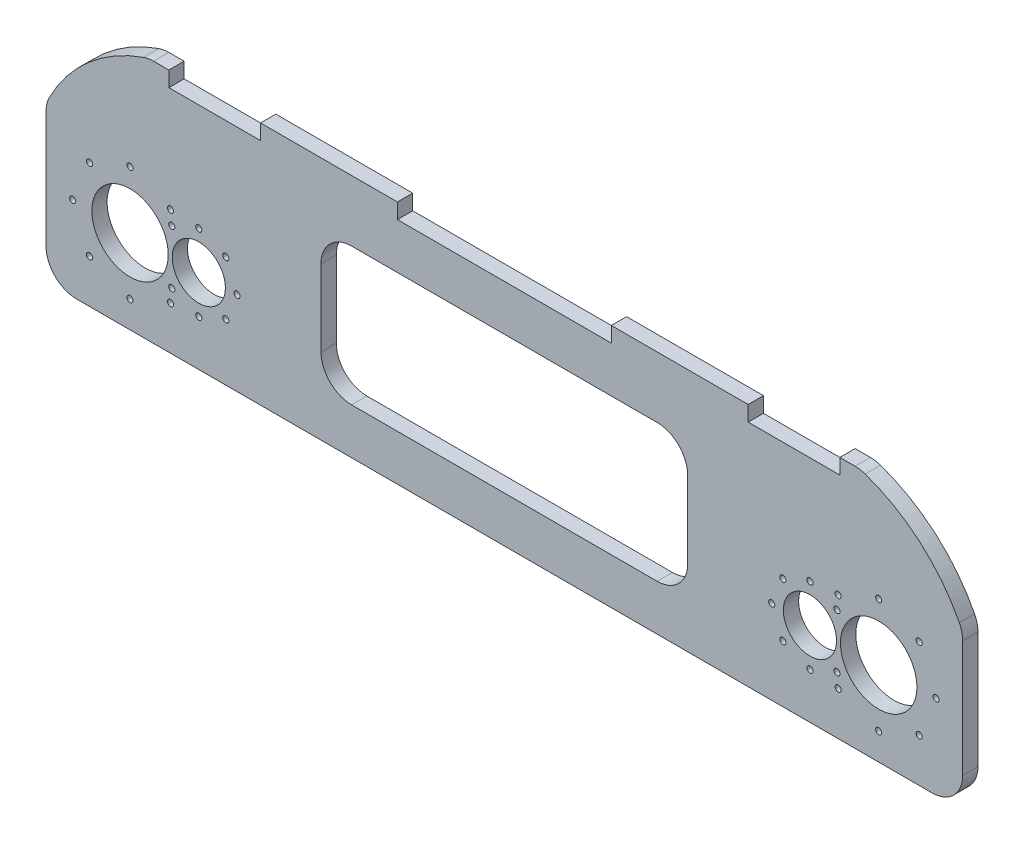
from build123d import *

# Parameters (mm, degrees)
SKETCH1_R           = 3.175
BOSS_EXTRUDE1_DEPTH = 3.175
SKETCH2_R           = 11.049
SKETCH2_R_2         = 15.875
SKETCH2_R_3         = 1.27
CUT_EXTRUDE1_DEPTH  = 202.930998425
SKETCH3_W           = 38.1
SKETCH3_H           = 6.35
SKETCH3_W_2         = 88.9
CUT_EXTRUDE4_DEPTH  = 202.930998425
CUT_EXTRUDE5_DEPTH  = 202.930998425


with BuildPart() as part:
    # Sketch1 → Boss-Extrude1 (new, symmetric)
    with BuildSketch(Plane.XY):
        with BuildLine():
            Line((-145.783553311, 66.675), (145.783553311, 66.675))
            ThreePointArc((145.783553311, 66.675), (147.900219978, 66.497368874), (149.957676269, 65.969444444))
            ThreePointArc((149.957676269, 65.969444444), (172.789871953, 52.74760778), (189.088888889, 31.999880883))
            ThreePointArc((189.088888889, 31.999880883), (190.142181511, 29.17513943), (190.5, 26.181720723))
            Line((190.5, 26.181720723), (190.5, -22.225))
            ThreePointArc((190.5, -22.225), (186.780256121, -31.205256121), (177.8, -34.925))
            Line((177.8, -34.925), (-177.8, -34.925))
            ThreePointArc((-177.8, -34.925), (-186.780256121, -31.205256121), (-190.5, -22.225))
            Line((-190.5, -22.225), (-190.5, 26.181720723))
            ThreePointArc((-190.5, 26.181720723), (-190.142181511, 29.17513943), (-189.088888889, 31.999880883))
            ThreePointArc((-189.088888889, 31.999880883), (-172.789871953, 52.74760778), (-149.957676269, 65.969444444))
            ThreePointArc((-149.957676269, 65.969444444), (-147.900219978, 66.497368874), (-145.783553311, 66.675))
        make_face()
        with Locations((-127, 0)):
            Circle(SKETCH1_R, mode=Mode.SUBTRACT)
        with Locations((127, 0)):
            Circle(SKETCH1_R, mode=Mode.SUBTRACT)
    extrude(amount=BOSS_EXTRUDE1_DEPTH, both=True)

    # Sketch2 → Cut-Extrude1 (cut, through all)
    with BuildSketch(Plane.XY.offset(3.175)):
        with Locations((-127, 0)):
            Circle(SKETCH2_R)
        with Locations((-155.575, 0)):
            Circle(SKETCH2_R_2)
        with Locations((-155.575, 23.8125)):
            Circle(SKETCH2_R_3)
        with Locations((-138.737019773, 16.837980227)):
            Circle(SKETCH2_R_3)
        with Locations((-138.737019773, -16.837980227)):
            Circle(SKETCH2_R_3)
        with Locations((-155.575, -23.8125)):
            Circle(SKETCH2_R_3)
        with Locations((-172.412980227, -16.837980227)):
            Circle(SKETCH2_R_3)
        with Locations((-179.3875, 0)):
            Circle(SKETCH2_R_3)
        with Locations((-172.412980227, 16.837980227)):
            Circle(SKETCH2_R_3)
        with Locations((-127, 15.875)):
            Circle(SKETCH2_R_3)
        with Locations((-115.774679849, 11.225320151)):
            Circle(SKETCH2_R_3)
        with Locations((-111.125, 0)):
            Circle(SKETCH2_R_3)
        with Locations((-115.774679849, -11.225320151)):
            Circle(SKETCH2_R_3)
        with Locations((-127, -15.875)):
            Circle(SKETCH2_R_3)
        with Locations((-138.225320151, -11.225320151)):
            Circle(SKETCH2_R_3)
        with Locations(Location((138.225320151, 11.225320151, 0), (0, 0, 180))):
            Circle(SKETCH2_R_3)
        with Locations((-138.225320151, 11.225320151)):
            Circle(SKETCH2_R_3)
        with Locations(Location((138.225320151, -11.225320151, 0), (0, 0, 180))):
            Circle(SKETCH2_R_3)
        with Locations(Location((127, -15.875, 0), (0, 0, 180))):
            Circle(SKETCH2_R_3)
        with Locations(Location((115.774679849, -11.225320151, 0), (0, 0, 180))):
            Circle(SKETCH2_R_3)
        with Locations(Location((111.125, 0, 0), (0, 0, 180))):
            Circle(SKETCH2_R_3)
        with Locations(Location((115.774679849, 11.225320151, 0), (0, 0, 180))):
            Circle(SKETCH2_R_3)
        with Locations(Location((127, 15.875, 0), (0, 0, 180))):
            Circle(SKETCH2_R_3)
        with Locations(Location((172.412980227, 16.837980227, 0), (0, 0, 180))):
            Circle(SKETCH2_R_3)
        with Locations(Location((179.3875, 0, 0), (0, 0, 180))):
            Circle(SKETCH2_R_3)
        with Locations(Location((172.412980227, -16.837980227, 0), (0, 0, 180))):
            Circle(SKETCH2_R_3)
        with Locations(Location((155.575, -23.8125, 0), (0, 0, 180))):
            Circle(SKETCH2_R_3)
        with Locations(Location((138.737019773, -16.837980227, 0), (0, 0, 180))):
            Circle(SKETCH2_R_3)
        with Locations(Location((138.737019773, 16.837980227, 0), (0, 0, 180))):
            Circle(SKETCH2_R_3)
        with Locations(Location((155.575, 23.8125, 0), (0, 0, 180))):
            Circle(SKETCH2_R_3)
        with Locations(Location((155.575, 0, 0), (0, 0, 180))):
            Circle(SKETCH2_R_2)
        with Locations(Location((127, 0, 0), (0, 0, 180))):
            Circle(SKETCH2_R)
    extrude(amount=-CUT_EXTRUDE1_DEPTH, mode=Mode.SUBTRACT)

    # Sketch3 → Cut-Extrude4 (cut, through all)
    with BuildSketch(Plane.XY.offset(3.175)):
        with Locations((-120.383553311, 63.5)):
            Rectangle(SKETCH3_W, SKETCH3_H)
        with Locations((120.383553311, 63.5)):
            Rectangle(SKETCH3_W, SKETCH3_H)
        with Locations((0, 63.5)):
            Rectangle(SKETCH3_W_2, SKETCH3_H)
    extrude(amount=-CUT_EXTRUDE4_DEPTH, mode=Mode.SUBTRACT)

    # Sketch4 → Cut-Extrude5 (cut, through all)
    with BuildSketch(Plane.XY.offset(3.175)):
        with BuildLine():
            Line((-63.5, 41.275), (63.5, 41.275))
            ThreePointArc((63.5, 41.275), (72.480256121, 37.555256121), (76.2, 28.575))
            Line((76.2, 28.575), (76.2, -3.175))
            ThreePointArc((76.2, -3.175), (72.480256121, -12.155256121), (63.5, -15.875))
            Line((63.5, -15.875), (-63.5, -15.875))
            ThreePointArc((-63.5, -15.875), (-72.480256121, -12.155256121), (-76.2, -3.175))
            Line((-76.2, -3.175), (-76.2, 28.575))
            ThreePointArc((-76.2, 28.575), (-72.480256121, 37.555256121), (-63.5, 41.275))
        make_face()
    extrude(amount=-CUT_EXTRUDE5_DEPTH, mode=Mode.SUBTRACT)


solid = part.part
